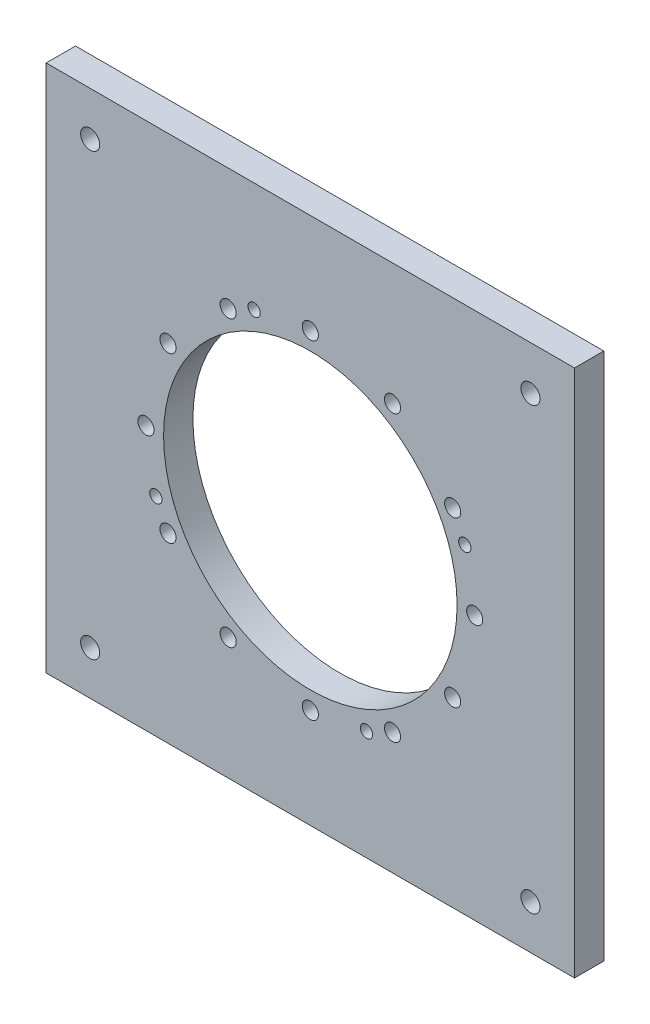
from build123d import *

# Parameters (mm, degrees)
SKETCH_1_W          = 180
SKETCH_1_H          = 180
EXTRUDE_1_DEPTH     = 10
SKETCH_2_R          = 50
SKETCH_2_R_2        = 2.75
SKETCH_2_R_3        = 2.1
SKETCH_2_R_4        = 3.25
CUT_EXTRUDE_1_DEPTH = 11


with BuildPart() as part:
    # 草图1 → 凸台-拉伸1 (new body)
    with BuildSketch(Plane.XY):
        Rectangle(SKETCH_1_W, SKETCH_1_H)
    extrude(amount=EXTRUDE_1_DEPTH)

    # 草图2 → 切除-拉伸1 (cut)
    with BuildSketch(Plane(origin=(0, 0, 0), x_dir=(-1, 0, 0), z_dir=(0, 0, -1))):
        Circle(SKETCH_2_R)
        with Locations((-56, 0)):
            Circle(SKETCH_2_R_2)
        with Locations((-48.497422612, 28)):
            Circle(SKETCH_2_R_2)
        with Locations((-28, 48.497422612)):
            Circle(SKETCH_2_R_2)
        with Locations((0, 56)):
            Circle(SKETCH_2_R_2)
        with Locations((28, 48.497422612)):
            Circle(SKETCH_2_R_2)
        with Locations((48.497422612, 28)):
            Circle(SKETCH_2_R_2)
        with Locations((56, 0)):
            Circle(SKETCH_2_R_2)
        with Locations((48.497422612, -28)):
            Circle(SKETCH_2_R_2)
        with Locations((28, -48.497422612)):
            Circle(SKETCH_2_R_2)
        with Locations((0, -56)):
            Circle(SKETCH_2_R_2)
        with Locations((-28, -48.497422612)):
            Circle(SKETCH_2_R_2)
        with Locations((-48.497422612, -28)):
            Circle(SKETCH_2_R_2)
        with Locations((-52.622786764, 19.153128026)):
            Circle(SKETCH_2_R_3)
        with Locations((19.153128026, 52.622786764)):
            Circle(SKETCH_2_R_3)
        with Locations((52.622786764, -19.153128026)):
            Circle(SKETCH_2_R_3)
        with Locations((-19.153128026, -52.622786764)):
            Circle(SKETCH_2_R_3)
        with Locations((75, -75)):
            Circle(SKETCH_2_R_4)
        with Locations((75, 75)):
            Circle(SKETCH_2_R_4)
        with Locations((-75, -75)):
            Circle(SKETCH_2_R_4)
        with Locations((-75, 75)):
            Circle(SKETCH_2_R_4)
    extrude(amount=-CUT_EXTRUDE_1_DEPTH, mode=Mode.SUBTRACT)


solid = part.part
